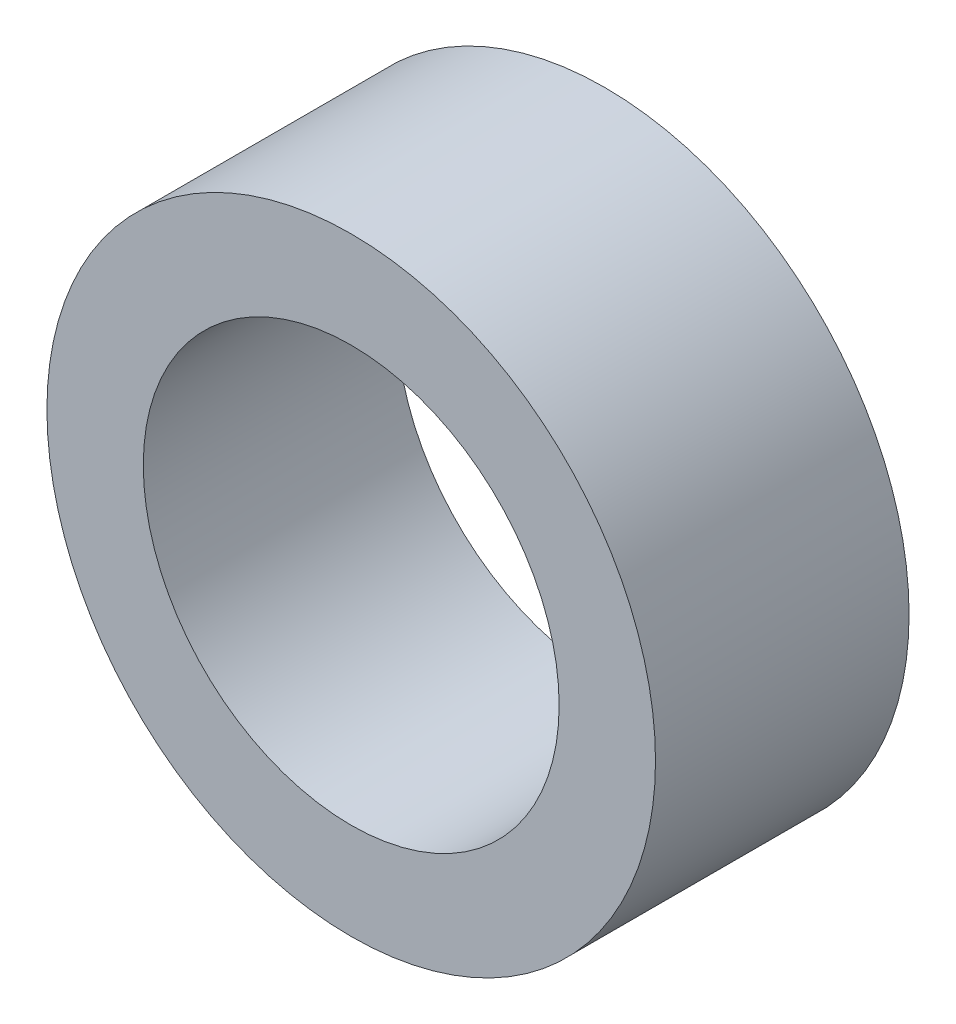
from build123d import *

# Parameters (mm, degrees)
SKETCH1_R           = 6
SKETCH1_R_2         = 4.1
BOSS_EXTRUDE1_DEPTH = 5


with BuildPart() as part:
    # Sketch1 → Boss-Extrude1 (new body)
    with BuildSketch(Plane.XY):
        Circle(SKETCH1_R)
        Circle(SKETCH1_R_2, mode=Mode.SUBTRACT)
    extrude(amount=BOSS_EXTRUDE1_DEPTH)


solid = part.part
